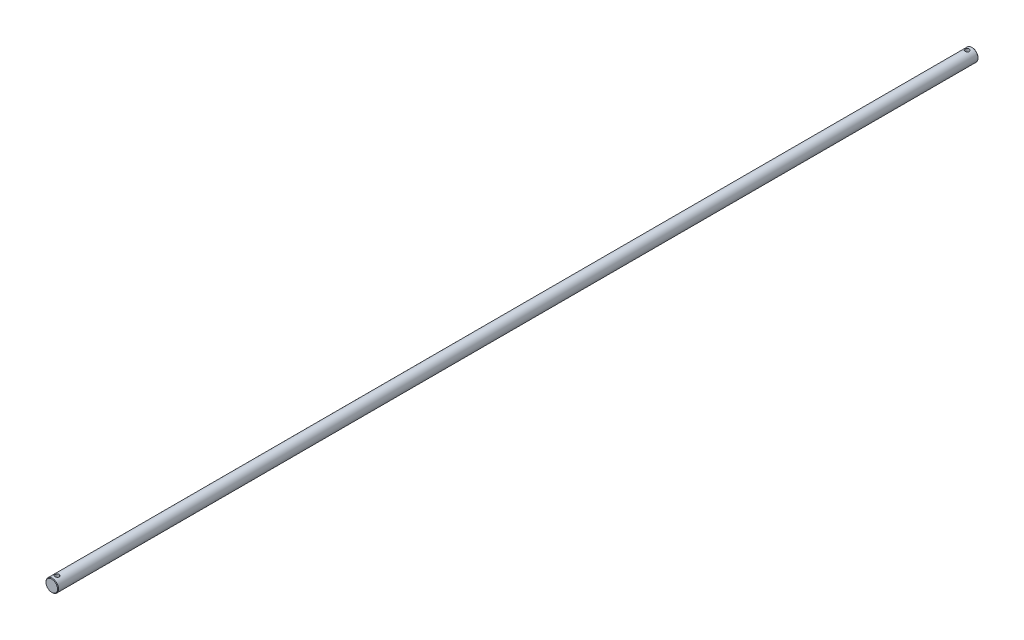
from build123d import *

# Parameters (mm, degrees)
DODANIE_WYCI_GNI_CIE1_DEPTH            = 880
DODANIE_WYCI_GNI_CIE1_DEPTH_BACK       = 880
SZKIC1_R                               = 12
WYTNIJ_WYCI_GNI_CIE1_REACH             = 882.164
SZKIC2_R                               = 4
WYTNIJ_WYCI_GNI_CIE1_DIRECTION_2_REACH = 882.164
SFAZOWANIE1_SIZE                       = 1


with BuildPart() as part:
    # Szkic1 → Dodanie-wyciągnięcie1 (new, two sides: drawn at the far end of the back side and taken through both)
    with BuildSketch(Plane.XY.offset(-DODANIE_WYCI_GNI_CIE1_DEPTH_BACK)):
        Circle(SZKIC1_R)
    extrude(amount=DODANIE_WYCI_GNI_CIE1_DEPTH + DODANIE_WYCI_GNI_CIE1_DEPTH_BACK)

    # Szkic2 → Wytnij-wyciągnięcie1 (cut, up to next)
    with BuildSketch(Plane(origin=(0, 0, 0), x_dir=(1, 0, 0), z_dir=(0, 1, 0)), mode=Mode.PRIVATE) as wytnij_wyci_gni_cie1_sk1:
        with Locations((0, 870)):
            Circle(SZKIC2_R)
    wytnij_wyci_gni_cie1_tool1 = extrude(wytnij_wyci_gni_cie1_sk1.sketch, amount=-WYTNIJ_WYCI_GNI_CIE1_REACH, mode=Mode.PRIVATE) & part.part
    # Szkic2 → Wytnij-wyciągnięcie1 (cut, up to next)
    with BuildSketch(Plane(origin=(0, 0, 0), x_dir=(1, 0, 0), z_dir=(0, 1, 0)), mode=Mode.PRIVATE) as wytnij_wyci_gni_cie1_sk2:
        with Locations((0, -870)):
            Circle(SZKIC2_R)
    wytnij_wyci_gni_cie1_tool2 = extrude(wytnij_wyci_gni_cie1_sk2.sketch, amount=-WYTNIJ_WYCI_GNI_CIE1_REACH, mode=Mode.PRIVATE) & part.part
    add(wytnij_wyci_gni_cie1_tool1.solids().sort_by_distance((0, 0, -870))[0], mode=Mode.SUBTRACT)
    add(wytnij_wyci_gni_cie1_tool2.solids().sort_by_distance((0, 0, 870))[0], mode=Mode.SUBTRACT)

    # Szkic2 → Wytnij-wyciągnięcie1 direction 2 (cut, up to next)
    with BuildSketch(Plane(origin=(0, 0, 0), x_dir=(1, 0, 0), z_dir=(0, 1, 0)), mode=Mode.PRIVATE) as wytnij_wyci_gni_cie1_direction_2_sk1:
        with Locations((0, 870)):
            Circle(SZKIC2_R)
    wytnij_wyci_gni_cie1_direction_2_tool1 = extrude(wytnij_wyci_gni_cie1_direction_2_sk1.sketch, amount=WYTNIJ_WYCI_GNI_CIE1_DIRECTION_2_REACH, mode=Mode.PRIVATE) & part.part
    # Szkic2 → Wytnij-wyciągnięcie1 direction 2 (cut, up to next)
    with BuildSketch(Plane(origin=(0, 0, 0), x_dir=(1, 0, 0), z_dir=(0, 1, 0)), mode=Mode.PRIVATE) as wytnij_wyci_gni_cie1_direction_2_sk2:
        with Locations((0, -870)):
            Circle(SZKIC2_R)
    wytnij_wyci_gni_cie1_direction_2_tool2 = extrude(wytnij_wyci_gni_cie1_direction_2_sk2.sketch, amount=WYTNIJ_WYCI_GNI_CIE1_DIRECTION_2_REACH, mode=Mode.PRIVATE) & part.part
    add(wytnij_wyci_gni_cie1_direction_2_tool1.solids().sort_by_distance((0, 0, -870))[0], mode=Mode.SUBTRACT)
    add(wytnij_wyci_gni_cie1_direction_2_tool2.solids().sort_by_distance((0, 0, 870))[0], mode=Mode.SUBTRACT)

    # Sfazowanie1
    sfazowanie1_edges = [part.edges().sort_by_distance(p)[0] for p in [
        (-12, 0, -880),
        (-12, 0, 880),
    ]]
    chamfer(sfazowanie1_edges, length=SFAZOWANIE1_SIZE)


solid = part.part
